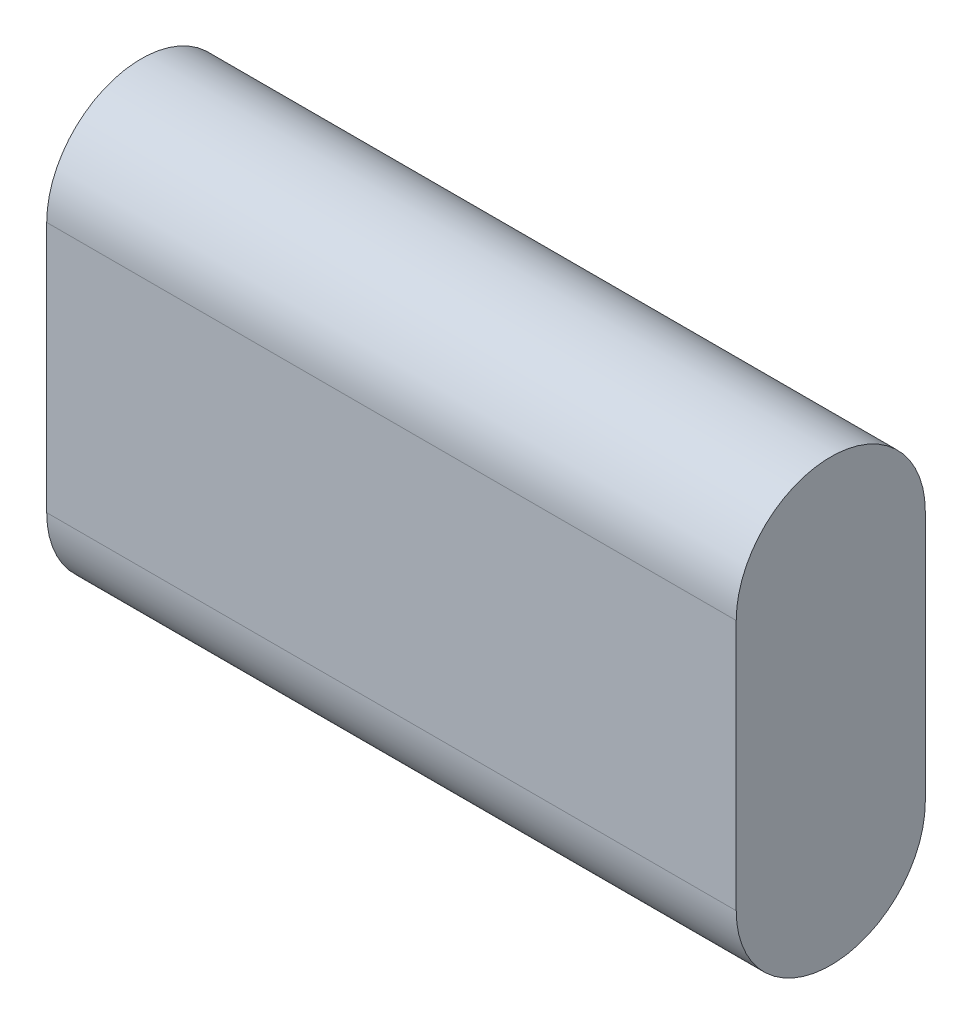
from build123d import *

# Parameters (mm, degrees)
EXTRUDE_1_DEPTH = 15.5


with BuildPart() as part:
    # ｽｹｯﾁ1 → ﾎﾞｽ - 押し出し1 (new, symmetric)
    with BuildSketch(Plane(origin=(0, 0, 0), x_dir=(0, 0, -1), z_dir=(1, 0, 0))):
        with BuildLine():
            Line((-4.25, -5.65), (-4.25, 5.65))
            ThreePointArc((-4.25, 5.65), (0, 9.9), (4.25, 5.65))
            Line((4.25, 5.65), (4.25, -5.65))
            ThreePointArc((4.25, -5.65), (0, -9.9), (-4.25, -5.65))
        make_face()
    extrude(amount=EXTRUDE_1_DEPTH, both=True)


solid = part.part
